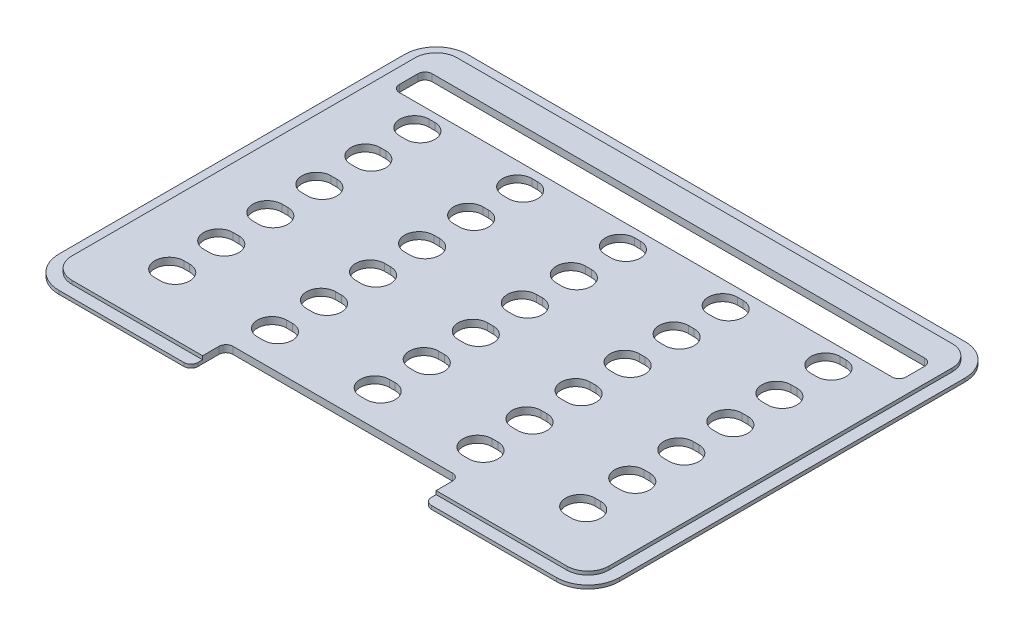
from build123d import *

# Parameters (mm, degrees)
SKETCH1_W                = 240
SKETCH1_H                = 175
OUTER_PROFILE_DEPTH      = 1.5
SKETCH2_W                = 230
SKETCH2_H                = 165
INNER_PROFILE_DEPTH      = 1.5
FILLET1_R                = 9
FILLET2_R                = 13.5
CUTOUT_DEPTH             = 149.543764595
CUTOUTS_COUNT            = 3
CUTOUTS_PITCH            = 44
CUTOUTS_COUNT_DIR2       = 6
CUTOUTS_PITCH_DIR2       = 21
MIRROR1_COPY_1_DEPTH     = 149.543764595
MIRROR1_COPY_2_DEPTH     = 149.543764595
MIRROR1_COPY_3_DEPTH     = 149.543764595
MIRROR1_COPY_4_DEPTH     = 149.543764595
MIRROR1_COPY_5_DEPTH     = 149.543764595
MIRROR1_COPY_6_DEPTH     = 149.543764595
MIRROR1_COPY_7_DEPTH     = 149.543764595
MIRROR1_COPY_8_DEPTH     = 149.543764595
MIRROR1_COPY_9_DEPTH     = 149.543764595
MIRROR1_COPY_10_DEPTH    = 149.543764595
MIRROR1_COPY_11_DEPTH    = 149.543764595
MIRROR1_COPY_12_DEPTH    = 149.543764595
MIRROR1_COPY_13_DEPTH    = 149.543764595
MIRROR1_COPY_14_DEPTH    = 149.543764595
MIRROR1_COPY_15_DEPTH    = 149.543764595
MIRROR1_COPY_16_DEPTH    = 149.543764595
MIRROR1_COPY_17_DEPTH    = 149.543764595
MIRROR1_COPY_18_DEPTH    = 149.543764595
SKETCH4_W                = 217
SKETCH4_H                = 14
MESSAGE_WINDOW_DEPTH     = 149.543764595
MESSAGE_WINDOW_CORNERS_R = 3
SKETCH6_W                = 100
SKETCH6_H                = 15
BASE_CUTBACK_DEPTH       = 149.543764595
FILLET5_R                = 3


with BuildPart() as part:
    # Sketch1 → Outer Profile (new body)
    with BuildSketch(Plane(origin=(0, 0, 0), x_dir=(1, 0, 0), z_dir=(0, 1, 0))):
        Rectangle(SKETCH1_W, SKETCH1_H)
    extrude(amount=OUTER_PROFILE_DEPTH)

    # Sketch2 → Inner Profile (add)
    with BuildSketch(Plane(origin=(0, 1.5, 0), x_dir=(1, 0, 0), z_dir=(0, 1, 0))):
        Rectangle(SKETCH2_W, SKETCH2_H)
    extrude(amount=INNER_PROFILE_DEPTH)

    # Fillet1
    fillet1_edges = [part.edges().sort_by_distance(p)[0] for p in [
        (115, 2.25, 82.5),
        (115, 2.25, -82.5),
        (-115, 2.25, -82.5),
        (-115, 2.25, 82.5),
    ]]
    fillet(fillet1_edges, radius=FILLET1_R)

    # Fillet2
    fillet2_edges = [part.edges().sort_by_distance(p)[0] for p in [
        (120, 0.75, 87.5),
        (-120, 0.75, 87.5),
        (-120, 0.75, -87.5),
        (120, 0.75, -87.5),
    ]]
    fillet(fillet2_edges, radius=FILLET2_R)

    # Sketch3 → Cutout (cut, through all)
    with BuildSketch(Plane(origin=(0, 3, 0), x_dir=(1, 0, 0), z_dir=(0, 1, 0))):
        with BuildLine():
            Line((-1.25, -51.25), (1.25, -51.25))
            ThreePointArc((1.25, -51.25), (7.5, -57.5), (1.25, -63.75))
            Line((1.25, -63.75), (-1.25, -63.75))
            ThreePointArc((-1.25, -63.75), (-7.5, -57.5), (-1.25, -51.25))
        make_face()
    cutout = extrude(amount=-CUTOUT_DEPTH, mode=Mode.SUBTRACT)

    # Cutouts: Cutout 3 × 6
    with Locations(*[(-i * CUTOUTS_PITCH, 0, -j * CUTOUTS_PITCH_DIR2) for i in range(CUTOUTS_COUNT) for j in range(CUTOUTS_COUNT_DIR2) if (i, j) != (0, 0)]):
        add(cutout, mode=Mode.SUBTRACT)

    # Mirror1 copy 1 sketch → Mirror1 copy 1 (cut, through all)
    with BuildSketch(Plane(origin=(0, 3, -21), x_dir=(-1, 0, 0), z_dir=(0, 1, 0))):
        with BuildLine():
            Line((-1.25, 51.25), (1.25, 51.25))
            ThreePointArc((1.25, 51.25), (7.5, 57.5), (1.25, 63.75))
            Line((1.25, 63.75), (-1.25, 63.75))
            ThreePointArc((-1.25, 63.75), (-7.5, 57.5), (-1.25, 51.25))
        make_face()
    extrude(amount=-MIRROR1_COPY_1_DEPTH, mode=Mode.SUBTRACT)

    # Mirror1 copy 2 sketch → Mirror1 copy 2 (cut, through all)
    with BuildSketch(Plane(origin=(0, 3, -42), x_dir=(-1, 0, 0), z_dir=(0, 1, 0))):
        with BuildLine():
            Line((-1.25, 51.25), (1.25, 51.25))
            ThreePointArc((1.25, 51.25), (7.5, 57.5), (1.25, 63.75))
            Line((1.25, 63.75), (-1.25, 63.75))
            ThreePointArc((-1.25, 63.75), (-7.5, 57.5), (-1.25, 51.25))
        make_face()
    extrude(amount=-MIRROR1_COPY_2_DEPTH, mode=Mode.SUBTRACT)

    # Mirror1 copy 3 sketch → Mirror1 copy 3 (cut, through all)
    with BuildSketch(Plane(origin=(0, 3, -63), x_dir=(-1, 0, 0), z_dir=(0, 1, 0))):
        with BuildLine():
            Line((-1.25, 51.25), (1.25, 51.25))
            ThreePointArc((1.25, 51.25), (7.5, 57.5), (1.25, 63.75))
            Line((1.25, 63.75), (-1.25, 63.75))
            ThreePointArc((-1.25, 63.75), (-7.5, 57.5), (-1.25, 51.25))
        make_face()
    extrude(amount=-MIRROR1_COPY_3_DEPTH, mode=Mode.SUBTRACT)

    # Mirror1 copy 4 sketch → Mirror1 copy 4 (cut, through all)
    with BuildSketch(Plane(origin=(0, 3, -84), x_dir=(-1, 0, 0), z_dir=(0, 1, 0))):
        with BuildLine():
            Line((-1.25, 51.25), (1.25, 51.25))
            ThreePointArc((1.25, 51.25), (7.5, 57.5), (1.25, 63.75))
            Line((1.25, 63.75), (-1.25, 63.75))
            ThreePointArc((-1.25, 63.75), (-7.5, 57.5), (-1.25, 51.25))
        make_face()
    extrude(amount=-MIRROR1_COPY_4_DEPTH, mode=Mode.SUBTRACT)

    # Mirror1 copy 5 sketch → Mirror1 copy 5 (cut, through all)
    with BuildSketch(Plane(origin=(0, 3, -105), x_dir=(-1, 0, 0), z_dir=(0, 1, 0))):
        with BuildLine():
            Line((-1.25, 51.25), (1.25, 51.25))
            ThreePointArc((1.25, 51.25), (7.5, 57.5), (1.25, 63.75))
            Line((1.25, 63.75), (-1.25, 63.75))
            ThreePointArc((-1.25, 63.75), (-7.5, 57.5), (-1.25, 51.25))
        make_face()
    extrude(amount=-MIRROR1_COPY_5_DEPTH, mode=Mode.SUBTRACT)

    # Mirror1 copy 6 sketch → Mirror1 copy 6 (cut, through all)
    with BuildSketch(Plane(origin=(44, 3, 0), x_dir=(-1, 0, 0), z_dir=(0, 1, 0))):
        with BuildLine():
            Line((-1.25, 51.25), (1.25, 51.25))
            ThreePointArc((1.25, 51.25), (7.5, 57.5), (1.25, 63.75))
            Line((1.25, 63.75), (-1.25, 63.75))
            ThreePointArc((-1.25, 63.75), (-7.5, 57.5), (-1.25, 51.25))
        make_face()
    extrude(amount=-MIRROR1_COPY_6_DEPTH, mode=Mode.SUBTRACT)

    # Mirror1 copy 7 sketch → Mirror1 copy 7 (cut, through all)
    with BuildSketch(Plane(origin=(44, 3, -21), x_dir=(-1, 0, 0), z_dir=(0, 1, 0))):
        with BuildLine():
            Line((-1.25, 51.25), (1.25, 51.25))
            ThreePointArc((1.25, 51.25), (7.5, 57.5), (1.25, 63.75))
            Line((1.25, 63.75), (-1.25, 63.75))
            ThreePointArc((-1.25, 63.75), (-7.5, 57.5), (-1.25, 51.25))
        make_face()
    extrude(amount=-MIRROR1_COPY_7_DEPTH, mode=Mode.SUBTRACT)

    # Mirror1 copy 8 sketch → Mirror1 copy 8 (cut, through all)
    with BuildSketch(Plane(origin=(44, 3, -42), x_dir=(-1, 0, 0), z_dir=(0, 1, 0))):
        with BuildLine():
            Line((-1.25, 51.25), (1.25, 51.25))
            ThreePointArc((1.25, 51.25), (7.5, 57.5), (1.25, 63.75))
            Line((1.25, 63.75), (-1.25, 63.75))
            ThreePointArc((-1.25, 63.75), (-7.5, 57.5), (-1.25, 51.25))
        make_face()
    extrude(amount=-MIRROR1_COPY_8_DEPTH, mode=Mode.SUBTRACT)

    # Mirror1 copy 9 sketch → Mirror1 copy 9 (cut, through all)
    with BuildSketch(Plane(origin=(44, 3, -63), x_dir=(-1, 0, 0), z_dir=(0, 1, 0))):
        with BuildLine():
            Line((-1.25, 51.25), (1.25, 51.25))
            ThreePointArc((1.25, 51.25), (7.5, 57.5), (1.25, 63.75))
            Line((1.25, 63.75), (-1.25, 63.75))
            ThreePointArc((-1.25, 63.75), (-7.5, 57.5), (-1.25, 51.25))
        make_face()
    extrude(amount=-MIRROR1_COPY_9_DEPTH, mode=Mode.SUBTRACT)

    # Mirror1 copy 10 sketch → Mirror1 copy 10 (cut, through all)
    with BuildSketch(Plane(origin=(44, 3, -84), x_dir=(-1, 0, 0), z_dir=(0, 1, 0))):
        with BuildLine():
            Line((-1.25, 51.25), (1.25, 51.25))
            ThreePointArc((1.25, 51.25), (7.5, 57.5), (1.25, 63.75))
            Line((1.25, 63.75), (-1.25, 63.75))
            ThreePointArc((-1.25, 63.75), (-7.5, 57.5), (-1.25, 51.25))
        make_face()
    extrude(amount=-MIRROR1_COPY_10_DEPTH, mode=Mode.SUBTRACT)

    # Mirror1 copy 11 sketch → Mirror1 copy 11 (cut, through all)
    with BuildSketch(Plane(origin=(44, 3, -105), x_dir=(-1, 0, 0), z_dir=(0, 1, 0))):
        with BuildLine():
            Line((-1.25, 51.25), (1.25, 51.25))
            ThreePointArc((1.25, 51.25), (7.5, 57.5), (1.25, 63.75))
            Line((1.25, 63.75), (-1.25, 63.75))
            ThreePointArc((-1.25, 63.75), (-7.5, 57.5), (-1.25, 51.25))
        make_face()
    extrude(amount=-MIRROR1_COPY_11_DEPTH, mode=Mode.SUBTRACT)

    # Mirror1 copy 12 sketch → Mirror1 copy 12 (cut, through all)
    with BuildSketch(Plane(origin=(88, 3, 0), x_dir=(-1, 0, 0), z_dir=(0, 1, 0))):
        with BuildLine():
            Line((-1.25, 51.25), (1.25, 51.25))
            ThreePointArc((1.25, 51.25), (7.5, 57.5), (1.25, 63.75))
            Line((1.25, 63.75), (-1.25, 63.75))
            ThreePointArc((-1.25, 63.75), (-7.5, 57.5), (-1.25, 51.25))
        make_face()
    extrude(amount=-MIRROR1_COPY_12_DEPTH, mode=Mode.SUBTRACT)

    # Mirror1 copy 13 sketch → Mirror1 copy 13 (cut, through all)
    with BuildSketch(Plane(origin=(88, 3, -21), x_dir=(-1, 0, 0), z_dir=(0, 1, 0))):
        with BuildLine():
            Line((-1.25, 51.25), (1.25, 51.25))
            ThreePointArc((1.25, 51.25), (7.5, 57.5), (1.25, 63.75))
            Line((1.25, 63.75), (-1.25, 63.75))
            ThreePointArc((-1.25, 63.75), (-7.5, 57.5), (-1.25, 51.25))
        make_face()
    extrude(amount=-MIRROR1_COPY_13_DEPTH, mode=Mode.SUBTRACT)

    # Mirror1 copy 14 sketch → Mirror1 copy 14 (cut, through all)
    with BuildSketch(Plane(origin=(88, 3, -42), x_dir=(-1, 0, 0), z_dir=(0, 1, 0))):
        with BuildLine():
            Line((-1.25, 51.25), (1.25, 51.25))
            ThreePointArc((1.25, 51.25), (7.5, 57.5), (1.25, 63.75))
            Line((1.25, 63.75), (-1.25, 63.75))
            ThreePointArc((-1.25, 63.75), (-7.5, 57.5), (-1.25, 51.25))
        make_face()
    extrude(amount=-MIRROR1_COPY_14_DEPTH, mode=Mode.SUBTRACT)

    # Mirror1 copy 15 sketch → Mirror1 copy 15 (cut, through all)
    with BuildSketch(Plane(origin=(88, 3, -63), x_dir=(-1, 0, 0), z_dir=(0, 1, 0))):
        with BuildLine():
            Line((-1.25, 51.25), (1.25, 51.25))
            ThreePointArc((1.25, 51.25), (7.5, 57.5), (1.25, 63.75))
            Line((1.25, 63.75), (-1.25, 63.75))
            ThreePointArc((-1.25, 63.75), (-7.5, 57.5), (-1.25, 51.25))
        make_face()
    extrude(amount=-MIRROR1_COPY_15_DEPTH, mode=Mode.SUBTRACT)

    # Mirror1 copy 16 sketch → Mirror1 copy 16 (cut, through all)
    with BuildSketch(Plane(origin=(88, 3, -84), x_dir=(-1, 0, 0), z_dir=(0, 1, 0))):
        with BuildLine():
            Line((-1.25, 51.25), (1.25, 51.25))
            ThreePointArc((1.25, 51.25), (7.5, 57.5), (1.25, 63.75))
            Line((1.25, 63.75), (-1.25, 63.75))
            ThreePointArc((-1.25, 63.75), (-7.5, 57.5), (-1.25, 51.25))
        make_face()
    extrude(amount=-MIRROR1_COPY_16_DEPTH, mode=Mode.SUBTRACT)

    # Mirror1 copy 17 sketch → Mirror1 copy 17 (cut, through all)
    with BuildSketch(Plane(origin=(88, 3, -105), x_dir=(-1, 0, 0), z_dir=(0, 1, 0))):
        with BuildLine():
            Line((-1.25, 51.25), (1.25, 51.25))
            ThreePointArc((1.25, 51.25), (7.5, 57.5), (1.25, 63.75))
            Line((1.25, 63.75), (-1.25, 63.75))
            ThreePointArc((-1.25, 63.75), (-7.5, 57.5), (-1.25, 51.25))
        make_face()
    extrude(amount=-MIRROR1_COPY_17_DEPTH, mode=Mode.SUBTRACT)

    # Mirror1 copy 18 sketch → Mirror1 copy 18 (cut, through all)
    with BuildSketch(Plane(origin=(0, 3, 0), x_dir=(-1, 0, 0), z_dir=(0, 1, 0))):
        with BuildLine():
            Line((-1.25, 51.25), (1.25, 51.25))
            ThreePointArc((1.25, 51.25), (7.5, 57.5), (1.25, 63.75))
            Line((1.25, 63.75), (-1.25, 63.75))
            ThreePointArc((-1.25, 63.75), (-7.5, 57.5), (-1.25, 51.25))
        make_face()
    extrude(amount=-MIRROR1_COPY_18_DEPTH, mode=Mode.SUBTRACT)

    # Sketch4 → Message Window (cut, through all)
    with BuildSketch(Plane(origin=(0, 3, 0), x_dir=(1, 0, 0), z_dir=(0, 1, 0))):
        with Locations((0, 64.25)):
            Rectangle(SKETCH4_W, SKETCH4_H)
    extrude(amount=-MESSAGE_WINDOW_DEPTH, mode=Mode.SUBTRACT)

    # Message Window Corners
    message_window_corners_edges = [part.edges().sort_by_distance(p)[0] for p in [
        (-108.5, 1.5, -57.25),
        (-108.5, 1.5, -71.25),
        (108.5, 1.5, -71.25),
        (108.5, 1.5, -57.25),
    ]]
    fillet(message_window_corners_edges, radius=MESSAGE_WINDOW_CORNERS_R)

    # Sketch6 → Base Cutback (cut, through all)
    with BuildSketch(Plane(origin=(0, 3, 0), x_dir=(1, 0, 0), z_dir=(0, 1, 0))):
        with Locations((0, -80)):
            Rectangle(SKETCH6_W, SKETCH6_H)
    extrude(amount=-BASE_CUTBACK_DEPTH, mode=Mode.SUBTRACT)

    # Fillet5
    fillet5_edges = [part.edges().sort_by_distance(p)[0] for p in [
        (50, 0.75, 87.5),
        (50, 1.5, 72.5),
        (-50, 0.75, 87.5),
        (-50, 1.5, 72.5),
    ]]
    fillet(fillet5_edges, radius=FILLET5_R)


solid = part.part
